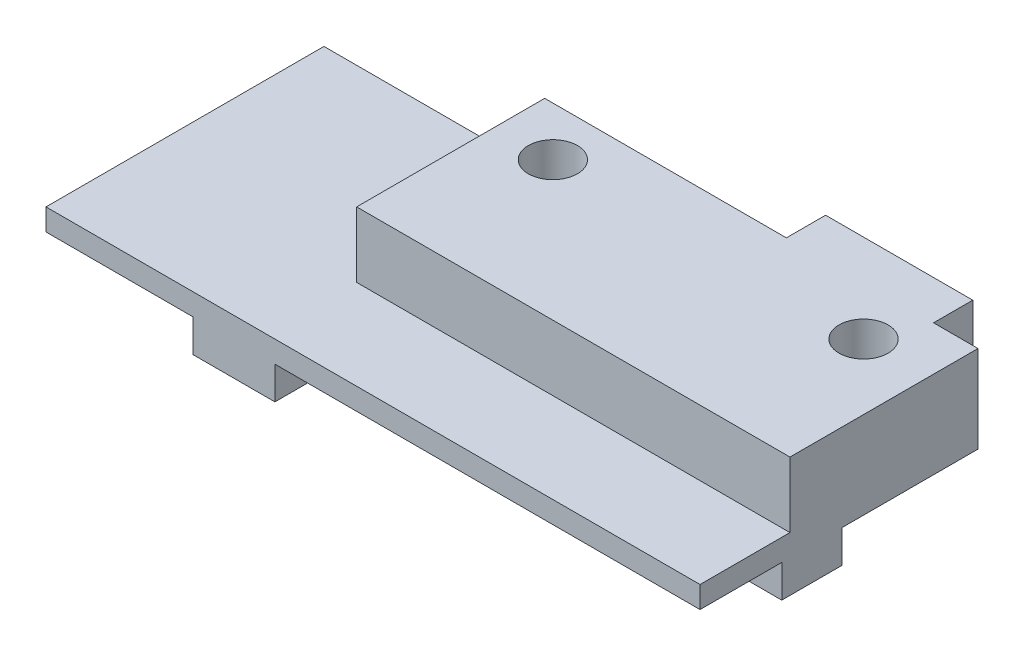
from build123d import *

# Parameters (mm, degrees)
SKETCH_1_W          = 40
SKETCH_1_H          = 17
EXTRUDE_1_DEPTH     = 1.33
SKETCH_2_W          = 9
SKETCH_2_H          = 2.4
EXTRUDE_2_DEPTH     = 4
SKETCH_3_W          = 26
SKETCH_3_H          = 3.69
EXTRUDE_3_DEPTH     = 2
SKETCH_4_R          = 1.5
CUT_EXTRUDE_1_DEPTH = 24.392710403


with BuildPart() as part:
    # Эскиз1 → Бобышка-Вытянуть1 (new body)
    with BuildSketch(Plane(origin=(0, 0, 0), x_dir=(1, 0, 0), z_dir=(0, 1, 0))):
        Rectangle(SKETCH_1_W, SKETCH_1_H)
    extrude(amount=EXTRUDE_1_DEPTH)

    # Эскиз2 → Бобышка-Вытянуть2 (add)
    with BuildSketch(Plane(origin=(0, 1.33, 0), x_dir=(1, 0, 0), z_dir=(0, 1, 0))):
        Polygon((20, -3), (20, 8.5), (17.28, 8.5), (8.28, 8.5), (-6.5, 8.5), (-6.5, -3), align=None)
        with Locations((12.78, 9.7)):
            Rectangle(SKETCH_2_W, SKETCH_2_H)
    extrude(amount=EXTRUDE_2_DEPTH)

    # Эскиз3 → Бобышка-Вытянуть3 (add)
    with BuildSketch(Plane.XZ):
        Polygon((-11, -8.5), (-6, -8.5), (-6, -0.19), (-6, 3.5), (-6, 8.5), (-11, 8.5), align=None)
        with Locations((7, 1.655)):
            Rectangle(SKETCH_3_W, SKETCH_3_H)
    extrude(amount=EXTRUDE_3_DEPTH)

    # Эскиз4 → Вырез-Вытянуть1 (cut, through all)
    with BuildSketch(Plane.XZ):
        with Locations(Location((16, -5.5, 0), (0, 0, 270))):
            Circle(SKETCH_4_R)
        with Locations(Location((-3, -5.5, 0), (0, 0, 270))):
            Circle(SKETCH_4_R)
    extrude(amount=-CUT_EXTRUDE_1_DEPTH, mode=Mode.SUBTRACT)


solid = part.part
